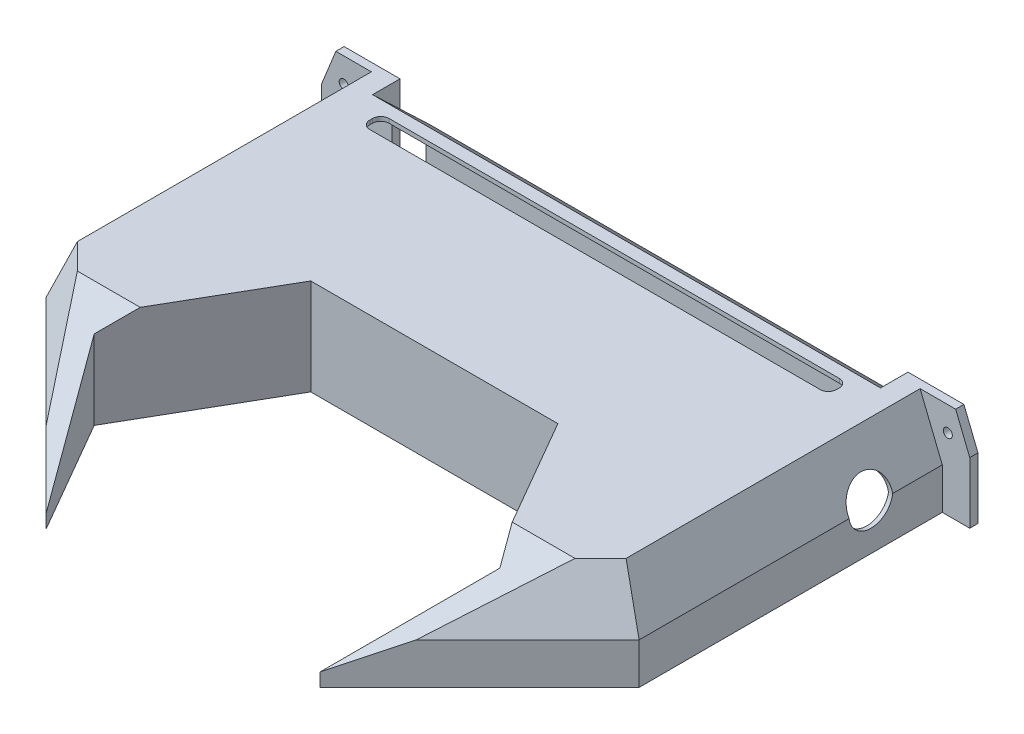
from build123d import *
from OCP.BRepFilletAPI import BRepFilletAPI_MakeChamfer

# Parameters (mm, degrees)
BOSS_EXTRU_1_DEPTH           = 35
ENL_V_MAT_EXTRU_1_DEPTH      = 146.832988115
ENL_V_MAT_EXTRU_1_DEPTH_BACK = 146.832988115
CHANFREIN2_SIZE              = 20
CHANFREIN2_SIZE2             = 8.080524517
BOSS_EXTRU_2_DEPTH           = 92.5
ENL_V_MAT_EXTRU_2_DEPTH      = 185
COQUE1_T                     = -1.5
ESQUISSE5_R                  = 8
ENL_V_MAT_EXTRU_3_DEPTH      = 238.190346394
ESQUISSE6_W                  = 170
ESQUISSE6_H                  = 7
ENL_V_MAT_EXTRU_4_DEPTH      = 146.832988115
CONG_1_R                     = 3
ESQUISSE7_R                  = 1.65
BOSS_EXTRU_3_DEPTH           = 3
ENL_V_MAT_EXTRU_5_DEPTH      = 185


with BuildPart() as part:
    # Esquisse1 → Boss.-Extru.1 (new body)
    with BuildSketch(Plane(origin=(0, 0, 0), x_dir=(1, 0, 0), z_dir=(0, 1, 0))):
        Polygon((-108, -33.421356237), (-49.888518291, -91.532837946), (-73.867513459, -50), (-45, 0), (0, 0), (0, 80), (-108, 80), align=None)
    extrude(amount=BOSS_EXTRU_1_DEPTH)

    # Esquisse2 → Enlèv. mat.-Extru.1 (cut, two sides: drawn at the far end of the back side and taken through both)
    with BuildSketch(Plane(origin=(0, 0, 0), x_dir=(0, 0, -1), z_dir=(1, 0, 0)).offset(-ENL_V_MAT_EXTRU_1_DEPTH_BACK)):
        Polygon((-91.532837946, 35), (-91.532837946, 4.888518291), (-39.378221735, 35), align=None)
    extrude(amount=ENL_V_MAT_EXTRU_1_DEPTH + ENL_V_MAT_EXTRU_1_DEPTH_BACK, mode=Mode.SUBTRACT)

    # Chanfrein2: one chamfer whose edges measure the first distance from different faces: ONE call of the kernel's chamfer builder (chamfer() names one face for all edges)
    chanfrein2_edges_1 = [part.edges().sort_by_distance(p)[0] for p in [
        (-108, 35, -23.289321881),
    ]]
    chanfrein2_side_1 = [part.faces().sort_by_distance(p)[0] for p in [
        (-108, 17.5, -23.289321881),
    ]]
    chanfrein2_edges_2 = [part.edges().sort_by_distance(p)[0] for p in [
        (-105.021567251, 35, 36.399788986),
    ]]
    chanfrein2_side_2 = [part.faces().sort_by_distance(p)[0] for p in [
        (-86.283455205, 12.807012464, 55.137901032),
    ]]
    chanfrein2 = BRepFilletAPI_MakeChamfer(part.part.solid().wrapped)
    for e in chanfrein2_edges_1:
        chanfrein2.Add(CHANFREIN2_SIZE, CHANFREIN2_SIZE2, e.wrapped, chanfrein2_side_1[0].wrapped)  # the first distance lies on this face
    for e in chanfrein2_edges_2:
        chanfrein2.Add(CHANFREIN2_SIZE, CHANFREIN2_SIZE2, e.wrapped, chanfrein2_side_2[0].wrapped)  # the first distance lies on this face
    add(Compound.cast(chanfrein2.Shape()), mode=Mode.REPLACE)

    # Symétrie1: part across plane


with BuildPart() as part_1:
    add(part.part)
    add(part.part.mirror(Plane(origin=(0, 35, -80), x_dir=(0, 0, 1), z_dir=(-1, 0, 0))))

    # Esquisse3 → Boss.-Extru.2 (add, symmetric)
    with BuildSketch(Plane(origin=(0, 0, 0), x_dir=(0, 0, -1), z_dir=(1, 0, 0))):
        Polygon((80, 25.476190476), (91, 15), (91, 0), (80, 0), align=None)
    extrude(amount=BOSS_EXTRU_2_DEPTH, both=True)

    # Esquisse4 → Enlèv. mat.-Extru.2 (cut)
    with BuildSketch(Plane(origin=(92.5, 0, 0), x_dir=(0, 0, -1), z_dir=(1, 0, 0))):
        Polygon((91, 15), (70, 35), (91, 35), align=None)
    extrude(amount=-ENL_V_MAT_EXTRU_2_DEPTH, mode=Mode.SUBTRACT)

    # Coque1
    coque1_openings = [part_1.faces().sort_by_distance(p)[0] for p in [
        (0, 0, -29.297783108),
    ]]
    offset(amount=COQUE1_T, openings=coque1_openings, kind=Kind.INTERSECTION)

    # Esquisse5 → Enlèv. mat.-Extru.3 (cut, through all)
    with BuildSketch(Plane.ZY.offset(108)):
        with Locations(Location((-51, 16, 0), (0, 0, 352.819244219))):
            Circle(ESQUISSE5_R)
    extrude(amount=-ENL_V_MAT_EXTRU_3_DEPTH, mode=Mode.SUBTRACT)

    # Esquisse6 → Enlèv. mat.-Extru.4 (cut, through all)
    with BuildSketch(Plane(origin=(0, 35, 0), x_dir=(1, 0, 0), z_dir=(0, 1, 0))):
        with Locations((0, 62)):
            Rectangle(ESQUISSE6_W, ESQUISSE6_H)
    extrude(amount=-ENL_V_MAT_EXTRU_4_DEPTH, mode=Mode.SUBTRACT)

    # Congé1
    cong_1_edges = [part_1.edges().sort_by_distance(p)[0] for p in [
        (85, 34.25, -65.5),
        (85, 34.25, -58.5),
        (-85, 34.25, -58.5),
        (-85, 34.25, -65.5),
    ]]
    fillet(cong_1_edges, radius=CONG_1_R)

    # Esquisse7 → Boss.-Extru.3 (add)
    # profile 1 of 2: a face of its own
    with BuildSketch(Plane(origin=(0, 0, -80), x_dir=(-1, 0, 0), z_dir=(0, 0, -1))):
        Polygon((-92.5, 0), (-118, 0), (-118, 22.282737416), (-112.861892395, 35), (-92.5, 35), align=None)
        with Locations((-110, 26.066629268)):
            Circle(ESQUISSE7_R, mode=Mode.SUBTRACT)
    # profile 2 of 2: a face of its own
    with BuildSketch(Plane(origin=(0, 0, -80), x_dir=(-1, 0, 0), z_dir=(0, 0, -1))):
        Polygon((92.5, 0), (118, 0), (118, 22.282737416), (112.861892395, 35), (92.5, 35), align=None)
        with Locations(Location((110, 26.066629268, 0), (0, 0, 180))):
            Circle(ESQUISSE7_R, mode=Mode.SUBTRACT)
    extrude(amount=-BOSS_EXTRU_3_DEPTH)

    # Esquisse8 → Enlèv. mat.-Extru.5 (cut)
    with BuildSketch(Plane.ZY.offset(-92.5)):
        Polygon((-78.5, 0), (-78.5, 24.833333333), (-89.5, 14.357142857), (-89.5, 0), align=None)
    extrude(amount=ENL_V_MAT_EXTRU_5_DEPTH, mode=Mode.SUBTRACT)


solid = part_1.part
